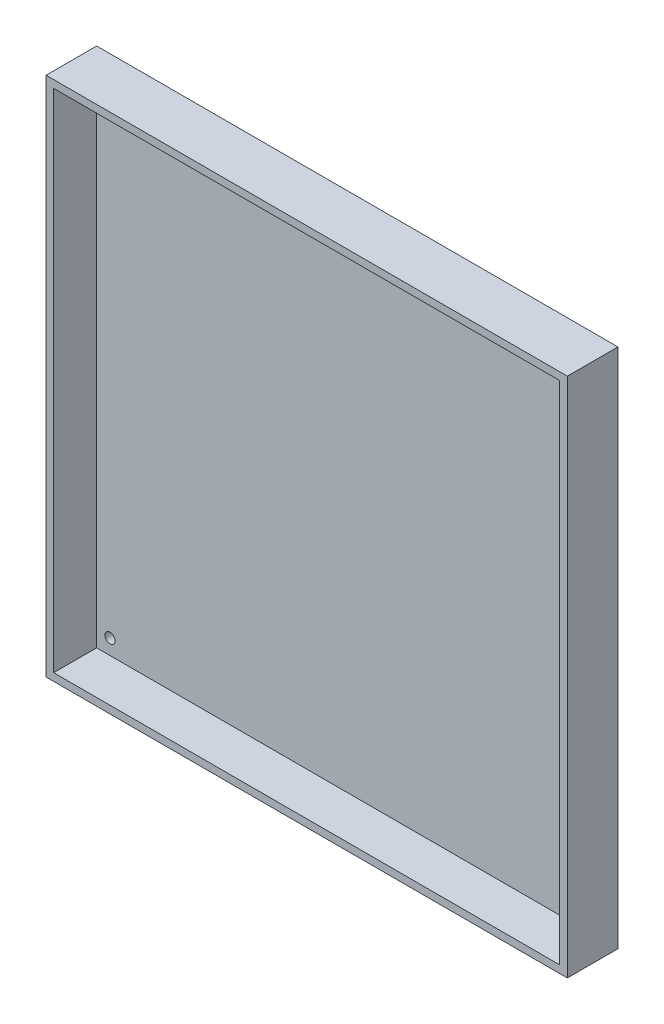
from build123d import *

# Parameters (mm, degrees)
SKETCH_1_W          = 103
SKETCH_1_H          = 103
EXTRUDE_1_DEPTH     = 1.5
SKETCH_3_W          = 103
SKETCH_3_H          = 103
SKETCH_3_W_2        = 100
SKETCH_3_H_2        = 100
EXTRUDE_2_DEPTH     = 8.5
SKETCH_4_R          = 1
CUT_EXTRUDE_1_DEPTH = 1.5


with BuildPart() as part:
    # 草图1 → 凸台-拉伸1 (new body)
    with BuildSketch(Plane.XY):
        with Locations((51.5, -51.5)):
            Rectangle(SKETCH_1_W, SKETCH_1_H)
    extrude(amount=EXTRUDE_1_DEPTH)

    # 草图3 → 凸台-拉伸2 (add)
    with BuildSketch(Plane.XY.offset(1.5)):
        with Locations((51.5, -51.5)):
            Rectangle(SKETCH_3_W, SKETCH_3_H)
        with Locations((51.5, -51.5)):
            Rectangle(SKETCH_3_W_2, SKETCH_3_H_2, mode=Mode.SUBTRACT)
    extrude(amount=EXTRUDE_2_DEPTH)

    # 草图4 → 切除-拉伸1 (cut)
    with BuildSketch(Plane.XY.offset(1.5)):
        with Locations((4.126355777, -98.5)):
            Circle(SKETCH_4_R)
        with Locations((98.5, -98.5)):
            Circle(SKETCH_4_R)
        with Locations((98.5, -4.5)):
            Circle(SKETCH_4_R)
        with Locations((4.5, -4.5)):
            Circle(SKETCH_4_R)
    extrude(amount=-CUT_EXTRUDE_1_DEPTH, mode=Mode.SUBTRACT)


solid = part.part
